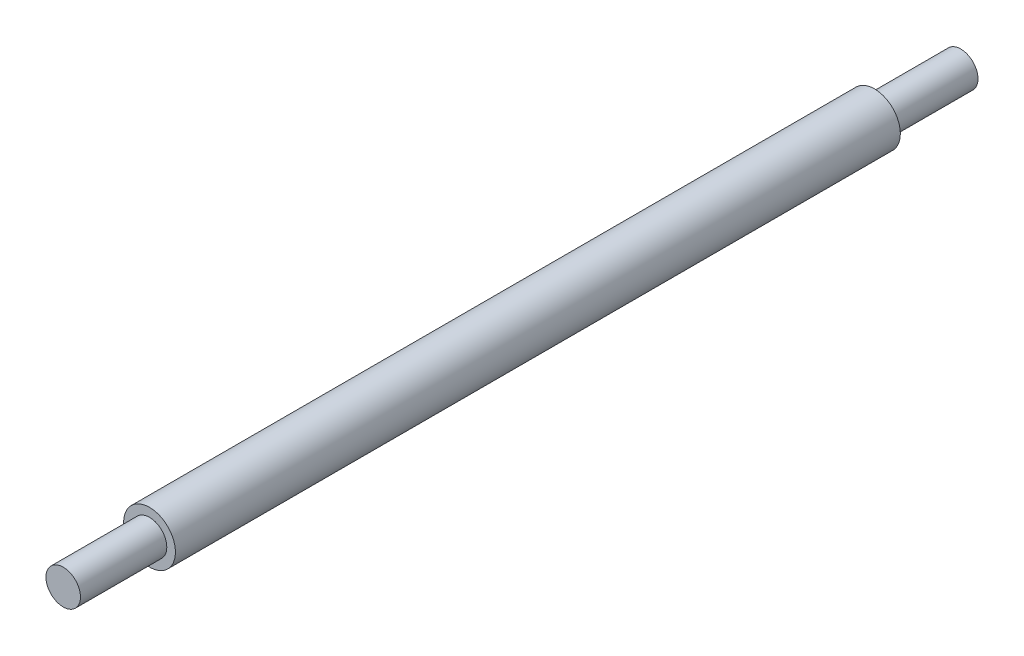
from build123d import *


with BuildPart() as part:
    # Sketch1 → Revolve1 (revolve)
    with BuildSketch(Plane(origin=(0, 0, 0), x_dir=(0, 0, -1), z_dir=(1, 0, 0)), mode=Mode.PRIVATE) as revolve1_sk:
        Polygon((-42, 3), (42, 3), (42, 2), (52, 2), (52, 0), (-52, 0), (-52, 2), (-42, 2), align=None)
    revolve(revolve1_sk.sketch.rotate(Axis((0, 0, 68.117647059), (0, 0, -1)), 90), axis=Axis((0, 0, 68.117647059), (0, 0, -1)))


solid = part.part
